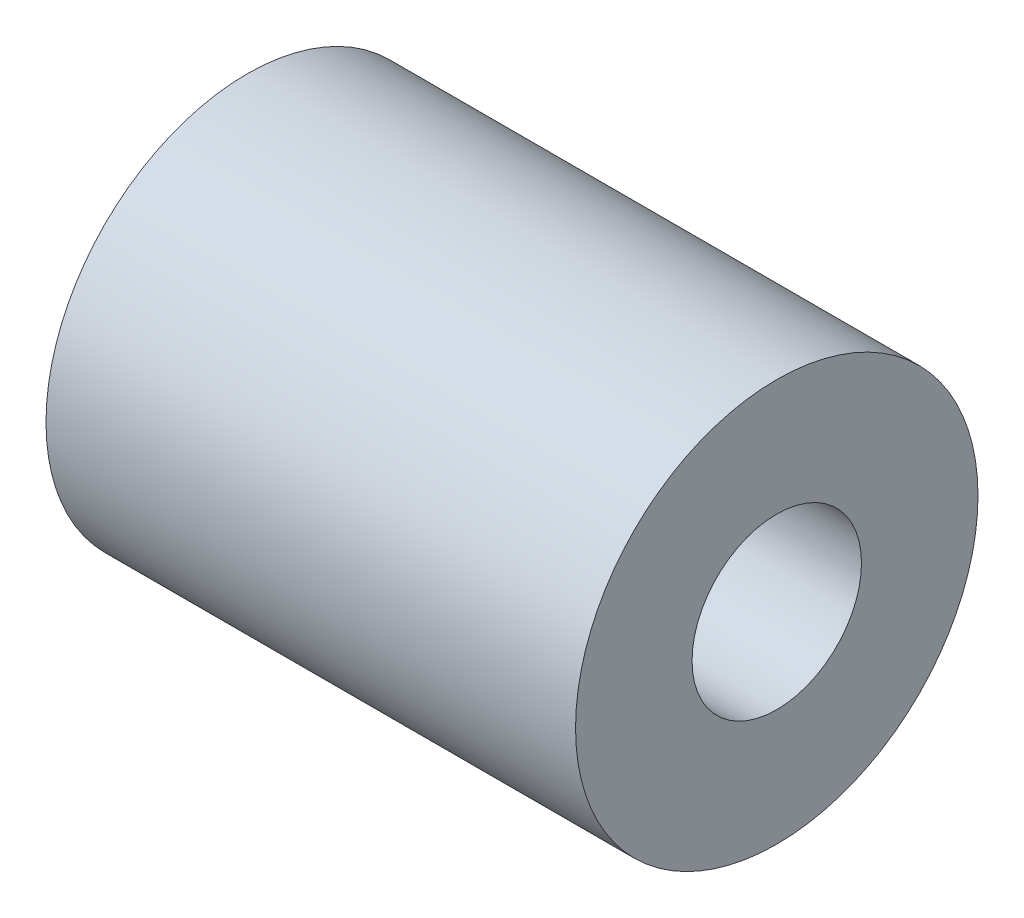
from build123d import *

# Parameters (mm, degrees)
SKETCH_1_R          = 9.5
EXTRUDE_1_DEPTH     = 25
SKETCH_2_R          = 2.5
CUT_EXTRUDE_1_DEPTH = 12.5
SKETCH_3_R          = 4
CUT_EXTRUDE_2_DEPTH = 12.5


with BuildPart() as part:
    # 草图1 → 凸台-拉伸1 (new body)
    with BuildSketch(Plane(origin=(0, 0, 0), x_dir=(0, 0, -1), z_dir=(1, 0, 0))):
        Circle(SKETCH_1_R)
    extrude(amount=EXTRUDE_1_DEPTH)

    # 草图2 → 切除-拉伸1 (cut)
    with BuildSketch(Plane.ZY):
        Circle(SKETCH_2_R)
    extrude(amount=-CUT_EXTRUDE_1_DEPTH, mode=Mode.SUBTRACT)

    # 草图3 → 切除-拉伸2 (cut)
    with BuildSketch(Plane(origin=(25, 0, 0), x_dir=(0, 0, -1), z_dir=(1, 0, 0))):
        Circle(SKETCH_3_R)
    extrude(amount=-CUT_EXTRUDE_2_DEPTH, mode=Mode.SUBTRACT)


solid = part.part
